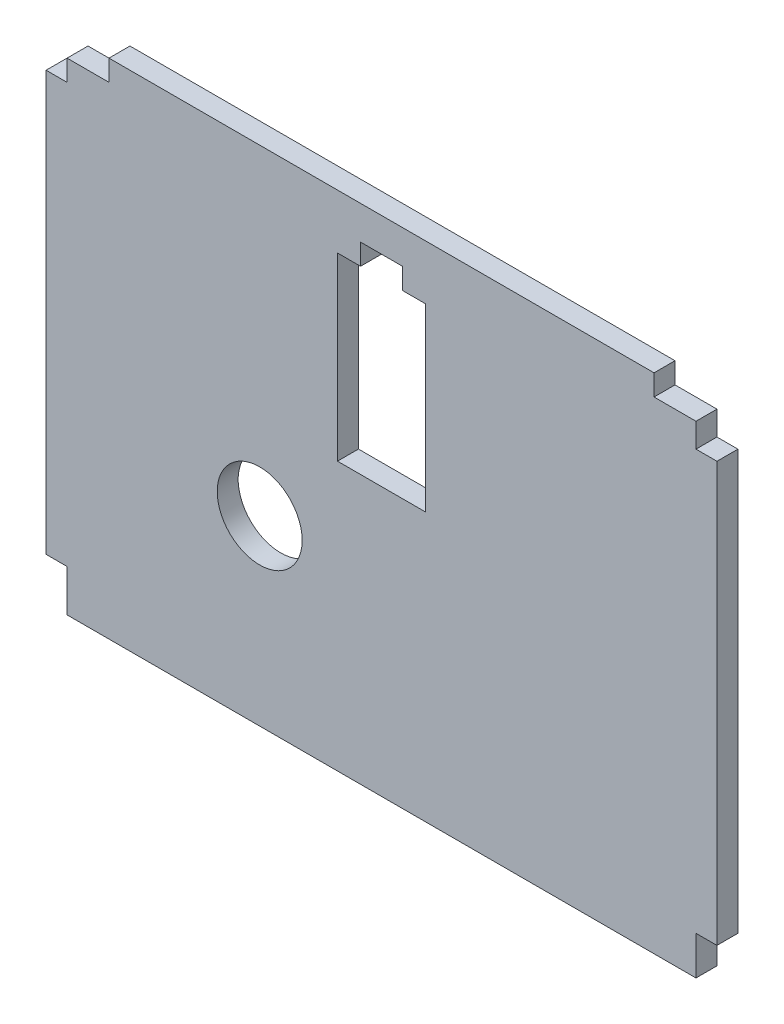
from build123d import *

# Parameters (mm, degrees)
BOSS_EXTRU_2_DEPTH      = 5
ENL_V_MAT_EXTRU_1_DEPTH = 5
ESQUISSE4_R             = 10.133372482
ENL_V_MAT_EXTRU_2_DEPTH = 10


with BuildPart() as part:
    # Esquisse1 → Boss.-Extru.2 (new body)
    with BuildSketch(Plane.XY):
        Polygon((-81.043275043, -69.971346705), (68.956724957, -69.971346705), (68.956724957, -60.737835253), (73.956724957, -60.737835253), (73.956724957, 39.262164747), (68.956724957, 39.262164747), (68.956724957, 45.028653295), (58.956724957, 45.028653295), (58.956724957, 50.028653295), (-71.043275043, 50.028653295), (-71.043275043, 45.028653295), (-81.043275043, 45.028653295), (-81.043275043, 40.028653295), (-86.043275043, 40.028653295), (-86.043275043, -59.971346705), (-81.043275043, -59.971346705), align=None)
    extrude(amount=BOSS_EXTRU_2_DEPTH)

    # Esquisse3 → Enlèv. mat.-Extru.1 (cut)
    with BuildSketch(Plane.XY.offset(5)):
        Polygon((-16.543275043, 37.028653295), (-16.543275043, -5.971346705), (4.456724957, -5.971346705), (4.456724957, 37.028653295), (-1.043275043, 37.028653295), (-1.043275043, 42.028653295), (-6.043275043, 42.028653295), (-11.043275043, 42.028653295), (-11.043275043, 37.028653295), align=None)
    extrude(amount=-ENL_V_MAT_EXTRU_1_DEPTH, mode=Mode.SUBTRACT)

    # Esquisse4 → Enlèv. mat.-Extru.2 (cut)
    with BuildSketch(Plane.XY.offset(5)):
        with Locations((-35.098604503, -26.562111751)):
            Circle(ESQUISSE4_R)
    extrude(amount=-ENL_V_MAT_EXTRU_2_DEPTH, mode=Mode.SUBTRACT)


solid = part.part
